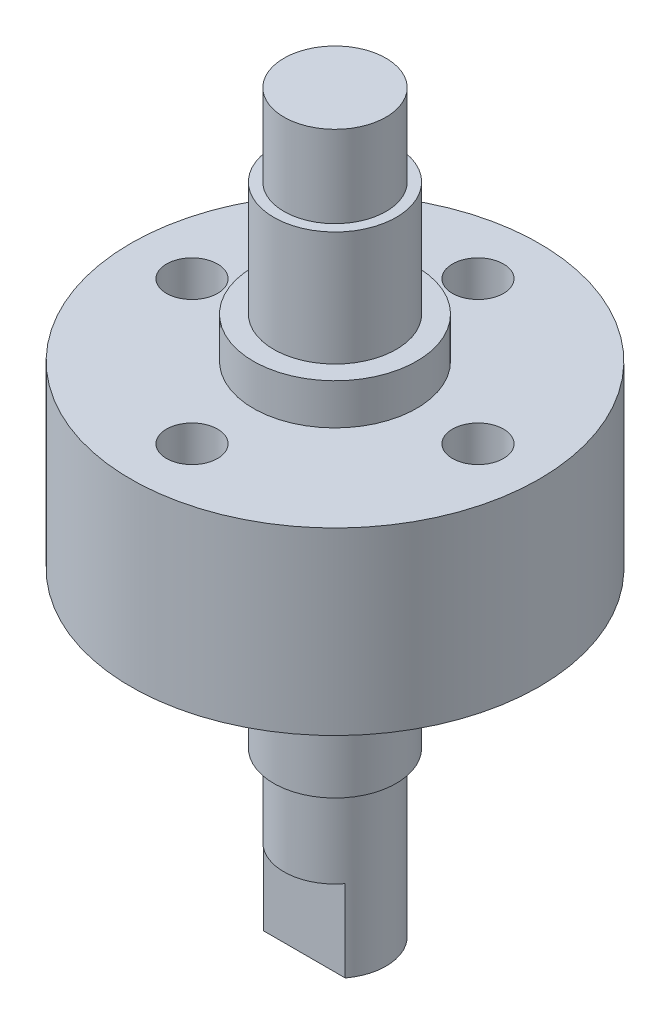
from build123d import *

# Parameters (mm, degrees)
HOLE_WIZARD_M3_1_D       = 2.5
PATTERN_CIRCULAR_1_COUNT = 4
CUT_EXTRUDE_1_DEPTH      = 4


with BuildPart() as part:
    # Model → 旋转1 (revolve)
    with BuildSketch(Plane.XY, mode=Mode.PRIVATE) as revolve_1_sk:
        Polygon((-1.786351506, 30.377960803), (-1.786351506, -5.622039197), (0.713648494, -5.622039197), (0.713648494, 2.377960803), (1.213648494, 2.377960803), (1.213648494, 7.977960803), (2.213648494, 7.977960803), (2.213648494, 9.977960803), (8.213648494, 9.977960803), (8.213648494, 18.777960803), (2.213648494, 18.777960803), (2.213648494, 20.777960803), (1.213648494, 20.777960803), (1.213648494, 26.377960803), (0.713648494, 26.377960803), (0.713648494, 30.377960803), align=None)
    revolve(revolve_1_sk.sketch.rotate(Axis((-1.786351506, 30.377960803, 0), (0, -1, 0)), 180), axis=Axis((-1.786351506, 30.377960803, 0), (0, -1, 0)))

    # M3 螺纹孔1 (through all)
    with Locations(Plane(origin=(-1.786351506, 9.977960803, 7), x_dir=(-1, 0, 0), z_dir=(0, -1, 0))):
        with Locations((0, 0)):
            hole_wizard_m3_1 = Hole(HOLE_WIZARD_M3_1_D / 2)

    # 阵列(圆周)1: M3 螺纹孔1 ×4 about axis
    pattern_circular_1_axis = Axis((-1.786351506, 0, 0), (0, 1, 0))
    for i in range(1, PATTERN_CIRCULAR_1_COUNT):
        add(hole_wizard_m3_1.rotate(pattern_circular_1_axis, i * 360 / PATTERN_CIRCULAR_1_COUNT), mode=Mode.SUBTRACT)

    # 草图5 → 切除-拉伸1 (cut)
    with BuildSketch(Plane.XZ.offset(5.622039197)):
        Polygon((-3.786351506, 1.5), (0.213648494, 1.5), (0.213648494, 5.333306347), (-4.133002322, 4.430820446), align=None)
    extrude(amount=-CUT_EXTRUDE_1_DEPTH, mode=Mode.SUBTRACT)


solid = part.part
